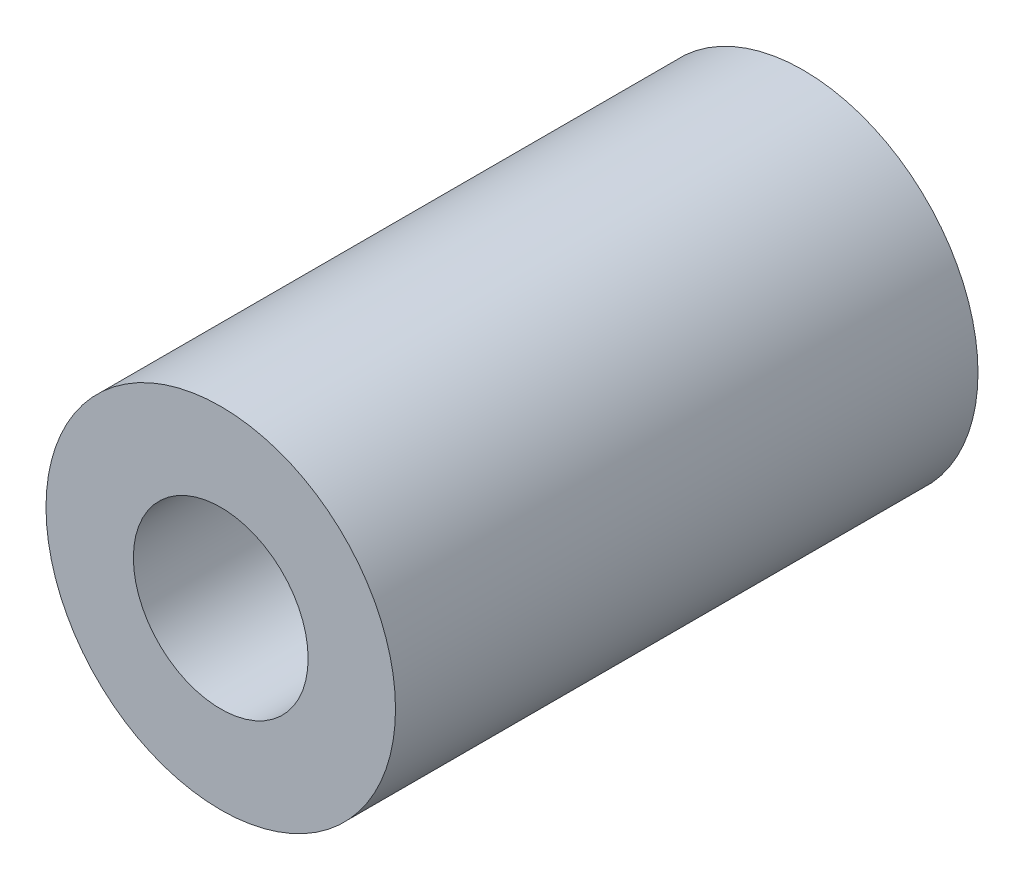
from build123d import *

# Parameters (mm, degrees)
SKETCH_1_R      = 3
SKETCH_1_R_2    = 1.5
EXTRUDE_1_DEPTH = 10


with BuildPart() as part:
    # 草图1 → 凸台-拉伸1 (new body)
    with BuildSketch(Plane.XY):
        Circle(SKETCH_1_R)
        Circle(SKETCH_1_R_2, mode=Mode.SUBTRACT)
    extrude(amount=EXTRUDE_1_DEPTH)


solid = part.part
